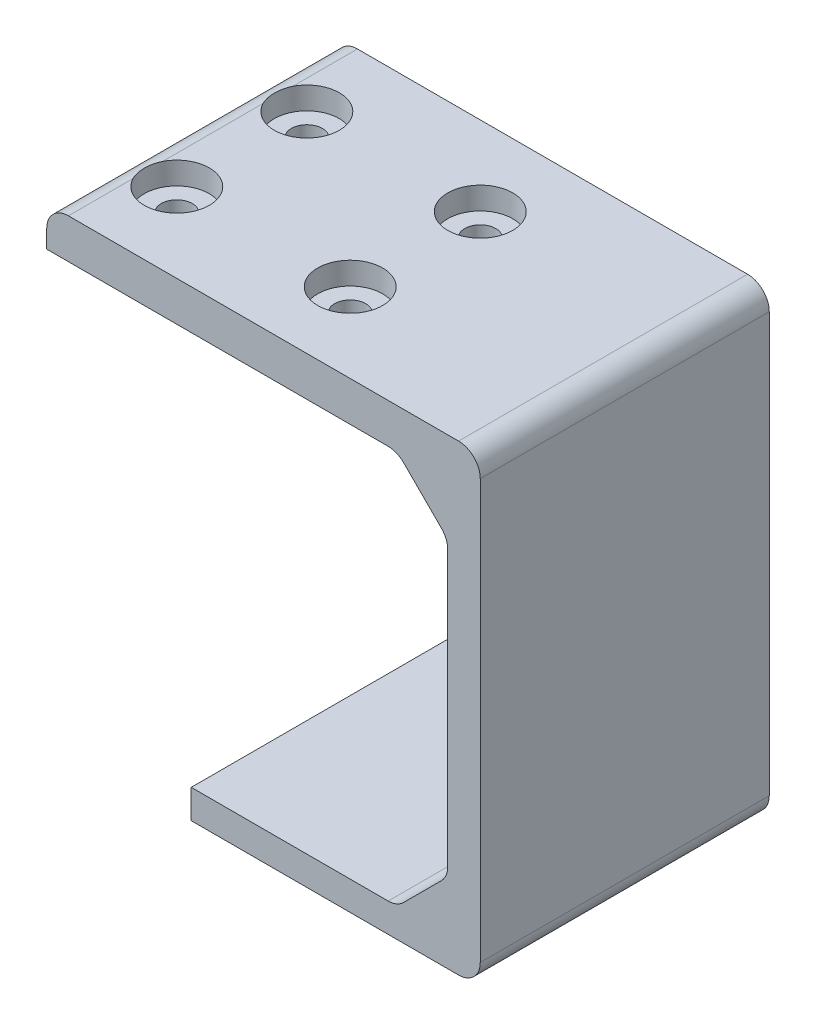
from build123d import *

# Parameters (mm, degrees)
BOSS_EXTRUDE1_DEPTH                              = 40
CHAMFER1_SIZE                                    = 7
FILLET1_R                                        = 3
CBORE_FOR_M4_PAN_HEAD_MACHINE_SCREW1_D           = 4.3
CBORE_FOR_M4_PAN_HEAD_MACHINE_SCREW1_DEPTH       = 5.5
CBORE_FOR_M4_PAN_HEAD_MACHINE_SCREW1_CBORE_D     = 9
CBORE_FOR_M4_PAN_HEAD_MACHINE_SCREW1_CBORE_DEPTH = 3.1


with BuildPart() as part:
    # Sketch1 → Boss-Extrude1 (new body)
    with BuildSketch(Plane.XY):
        Polygon((0, 32), (0, -32), (-40, -32), (-40, -28), (-4.5, -28), (-4.5, 26.5), (-60, 26.5), (-60, 32), align=None)
    extrude(amount=BOSS_EXTRUDE1_DEPTH)

    # Chamfer1
    chamfer1_edges = [part.edges().sort_by_distance(p)[0] for p in [
        (-4.5, -28, 20),
        (-4.5, 26.5, 20),
    ]]
    chamfer(chamfer1_edges, length=CHAMFER1_SIZE)

    # Fillet1
    fillet1_edges = [part.edges().sort_by_distance(p)[0] for p in [
        (-60, 32, 20),
        (0, 32, 20),
        (0, -32, 20),
        (-11.5, -28, 20),
        (-4.5, 19.5, 20),
        (-4.5, -21, 20),
        (-11.5, 26.5, 20),
    ]]
    fillet(fillet1_edges, radius=FILLET1_R)

    # CBORE for M4 Pan Head Machine Screw1
    with Locations(Plane(origin=(0, 32, 0), x_dir=(1, 0, 0), z_dir=(0, 1, 0))):
        with Locations((-53, -11), (-53, -29), (-29, -29), (-29, -11)):
            CounterBoreHole(CBORE_FOR_M4_PAN_HEAD_MACHINE_SCREW1_D / 2, CBORE_FOR_M4_PAN_HEAD_MACHINE_SCREW1_CBORE_D / 2, CBORE_FOR_M4_PAN_HEAD_MACHINE_SCREW1_CBORE_DEPTH, depth=CBORE_FOR_M4_PAN_HEAD_MACHINE_SCREW1_DEPTH)


solid = part.part
